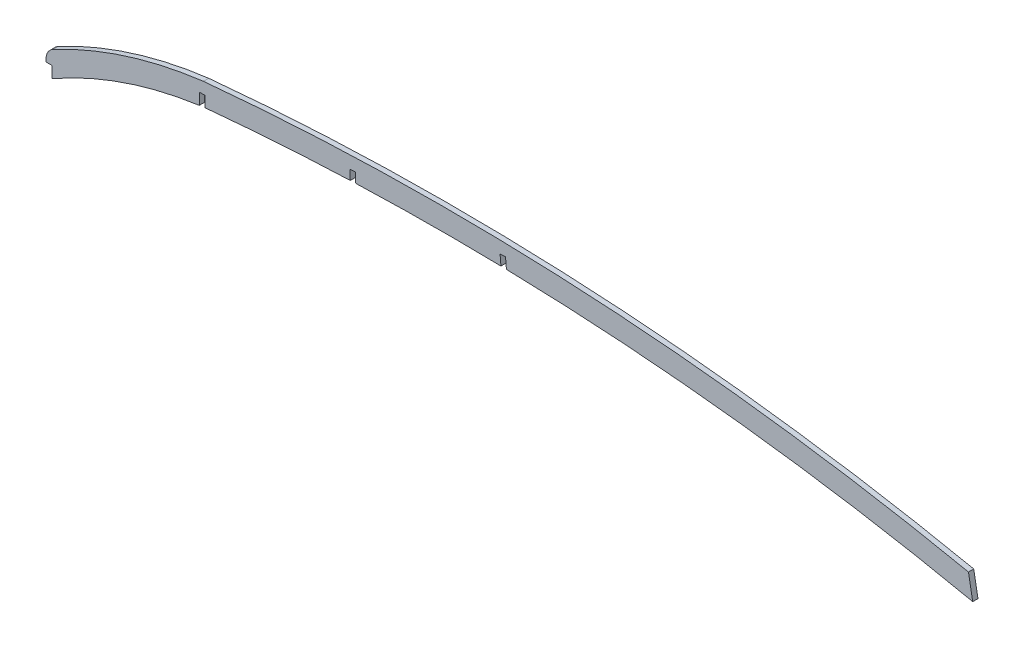
from build123d import *

# Parameters (mm, degrees)
BOSS_EXTRUDE1_DEPTH = 1.5875


with BuildPart() as part:
    # Sketch1 → Boss-Extrude1 (new, symmetric)
    with BuildSketch(Plane.XY):
        with BuildLine():
            Line((277.352525484, 130.514220253), (276.807932827, 136.840824305))
            Line((276.807932827, 136.840824305), (273.51809872, 136.557636124))
            Line((273.51809872, 136.557636124), (274.031797499, 130.589930281))
            ThreePointArc((274.031797499, 130.589930281), (230.30851429, 130.913472194), (186.59387592, 129.985805221))
            Line((186.59387592, 129.985805221), (186.349272737, 135.827805221))
            Line((186.349272737, 135.827805221), (183.050163268, 135.689672274))
            Line((183.050163268, 135.689672274), (183.294042864, 129.86495412))
            ThreePointArc((183.294042864, 129.86495412), (139.761460521, 127.601280315), (96.311168805, 124.096698424))
            ThreePointArc((96.311168805, 124.096698424), (95.971054745, 124.054032816), (95.631, 124.010897007))
            Line((95.631, 124.010897007), (95.631, 130.517973266))
            Line((95.631, 130.517973266), (92.329, 130.517973266))
            Line((92.329, 130.517973266), (92.329, 123.567152459))
            ThreePointArc((92.329, 123.567152459), (46.592607477, 112.602219611), (3.749926944, 93.197269774))
            Line((3.749926944, 93.197269774), (3.749926944, 100.055269774))
            Line((3.749926944, 100.055269774), (0, 100.055269774))
            Line((0, 100.055269774), (0, 101.6))
            ThreePointArc((0, 101.6), (1.157792804, 105.775489723), (4.300521626, 108.758517405))
            ThreePointArc((4.300521626, 108.758517405), (48.266347056, 127.216011607), (94.854415026, 137.375973266))
            ThreePointArc((94.854415026, 137.375973266), (326.208122032, 141.94293007), (555.638244479, 111.822940798))
            Line((555.638244479, 111.822940798), (558.229469453, 97.627349478))
            ThreePointArc((558.229469453, 97.627349478), (418.553478483, 120.58290755), (277.352525484, 130.514220253))
        make_face()
    extrude(amount=BOSS_EXTRUDE1_DEPTH, both=True)


solid = part.part
